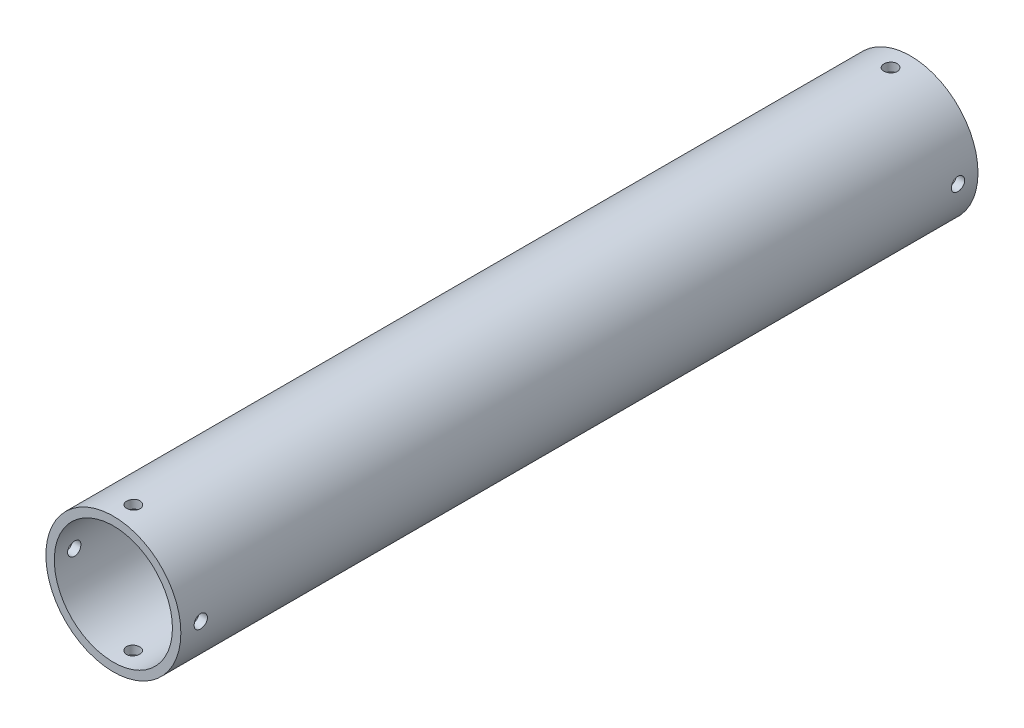
from build123d import *

# Parameters (mm, degrees)
ESBO_O1_R                = 25.4
ESBO_O1_R_2              = 22.23
RESSALTO_EXTRUS_O1_DEPTH = 300
CORTE_EXTRUS_O1_REACH    = 307.329
ESBO_O3_R                = 2.5
PADR_OCIRCULAR1_COUNT    = 4
CORTE_EXTRUS_O2_REACH    = 307.329
ESBO_O4_R                = 2.5
PADR_OCIRCULAR2_COUNT    = 4


with BuildPart() as part:
    # Esboço1 → Ressalto-extrusão1 (new body)
    with BuildSketch(Plane.XY):
        Circle(ESBO_O1_R)
        Circle(ESBO_O1_R_2, mode=Mode.SUBTRACT)
    extrude(amount=RESSALTO_EXTRUS_O1_DEPTH)

    # Esboço3 → Corte-extrusão1 (cut, up to next)
    with BuildSketch(Plane(origin=(0, 25.4, 0), x_dir=(1, 0, 0), z_dir=(0, 1, 0)), mode=Mode.PRIVATE) as corte_extrus_o1_sk1:
        with Locations((0, -292.5)):
            Circle(ESBO_O3_R)
    corte_extrus_o1_tool1 = extrude(corte_extrus_o1_sk1.sketch, amount=-CORTE_EXTRUS_O1_REACH, mode=Mode.PRIVATE) & part.part
    corte_extrus_o1 = corte_extrus_o1_tool1.solids().sort_by_distance((0, 25.4, 292.5))[0]
    add(corte_extrus_o1, mode=Mode.SUBTRACT)

    # PadrãoCircular1: Corte-extrusão1 ×4 about axis
    padr_ocircular1_axis = Axis((0, 0, 300), (0, 0, 1))
    for i in range(1, PADR_OCIRCULAR1_COUNT):
        add(corte_extrus_o1.rotate(padr_ocircular1_axis, i * 360 / PADR_OCIRCULAR1_COUNT), mode=Mode.SUBTRACT)

    # Esboço4 → Corte-extrusão2 (cut, up to next)
    with BuildSketch(Plane(origin=(0, 25.4, 0), x_dir=(1, 0, 0), z_dir=(0, 1, 0)), mode=Mode.PRIVATE) as corte_extrus_o2_sk1:
        with Locations((-0.017770346, -7.5)):
            Circle(ESBO_O4_R)
    corte_extrus_o2_tool1 = extrude(corte_extrus_o2_sk1.sketch, amount=-CORTE_EXTRUS_O2_REACH, mode=Mode.PRIVATE) & part.part
    corte_extrus_o2 = corte_extrus_o2_tool1.solids().sort_by_distance((-0.01777, 25.4, 7.5))[0]
    add(corte_extrus_o2, mode=Mode.SUBTRACT)

    # PadrãoCircular2: Corte-extrusão2 ×4 about axis
    padr_ocircular2_axis = Axis((0, 0, 0), (0, 0, 1))
    for i in range(1, PADR_OCIRCULAR2_COUNT):
        add(corte_extrus_o2.rotate(padr_ocircular2_axis, i * 360 / PADR_OCIRCULAR2_COUNT), mode=Mode.SUBTRACT)


solid = part.part
